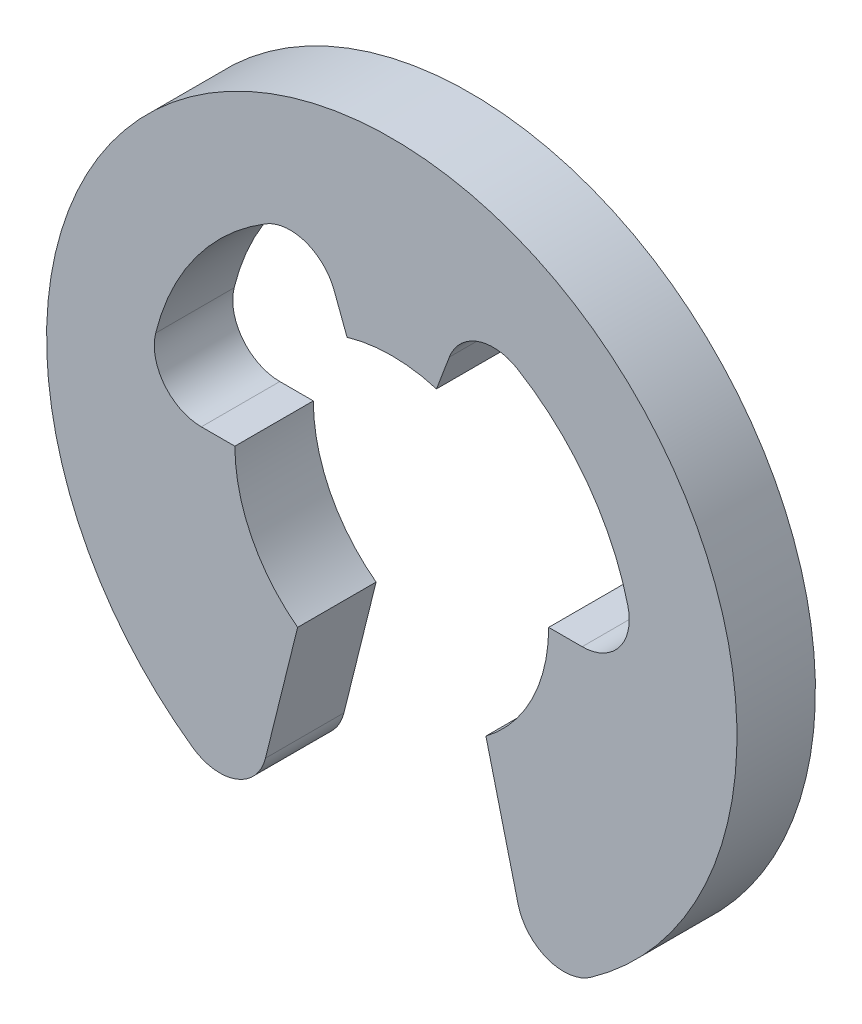
from build123d import *

# Parameters (mm, degrees)
BOSS_EXTRUDE1_DEPTH = 0.5
FILLET1_R           = 0.3


with BuildPart() as part:
    # Sketch2 → Boss-Extrude1 (new body)
    with BuildSketch(Plane.XY):
        with BuildLine():
            Line((0.6, -0.8), (0.899946983, -2.007509758))
            ThreePointArc((0.899946983, -2.007509758), (0, 2.2), (-0.899946983, -2.007509758))
            Line((-0.899946983, -2.007509758), (-0.6, -0.8))
            ThreePointArc((-0.6, -0.8), (-0.894427191, -0.447213595), (-1, 0))
            Line((-1, 0), (-1.55, 0))
            ThreePointArc((-1.55, 0), (-1.25421202, 0.910742669), (-0.479739085, 1.473889552))
            Line((-0.479739085, 1.473889552), (-0.285, 0.958527517))
            ThreePointArc((-0.285, 0.958527517), (0, 1), (0.285, 0.958527517))
            Line((0.285, 0.958527517), (0.479739085, 1.473889552))
            ThreePointArc((0.479739085, 1.473889552), (1.25421202, 0.910742669), (1.55, 0))
            Line((1.55, 0), (1, 0))
            ThreePointArc((1, 0), (0.894427191, -0.447213595), (0.6, -0.8))
        make_face()
    extrude(amount=BOSS_EXTRUDE1_DEPTH)

    # Fillet1
    fillet1_edges = [part.edges().sort_by_distance(p)[0] for p in [
        (1.55, 0, 0.25),
        (0.479739085, 1.473889552, 0.25),
        (-0.479739085, 1.473889552, 0.25),
        (-1.55, 0, 0.25),
        (-0.899946983, -2.007509758, 0.25),
        (0.899946983, -2.007509758, 0.25),
    ]]
    fillet(fillet1_edges, radius=FILLET1_R)


solid = part.part
